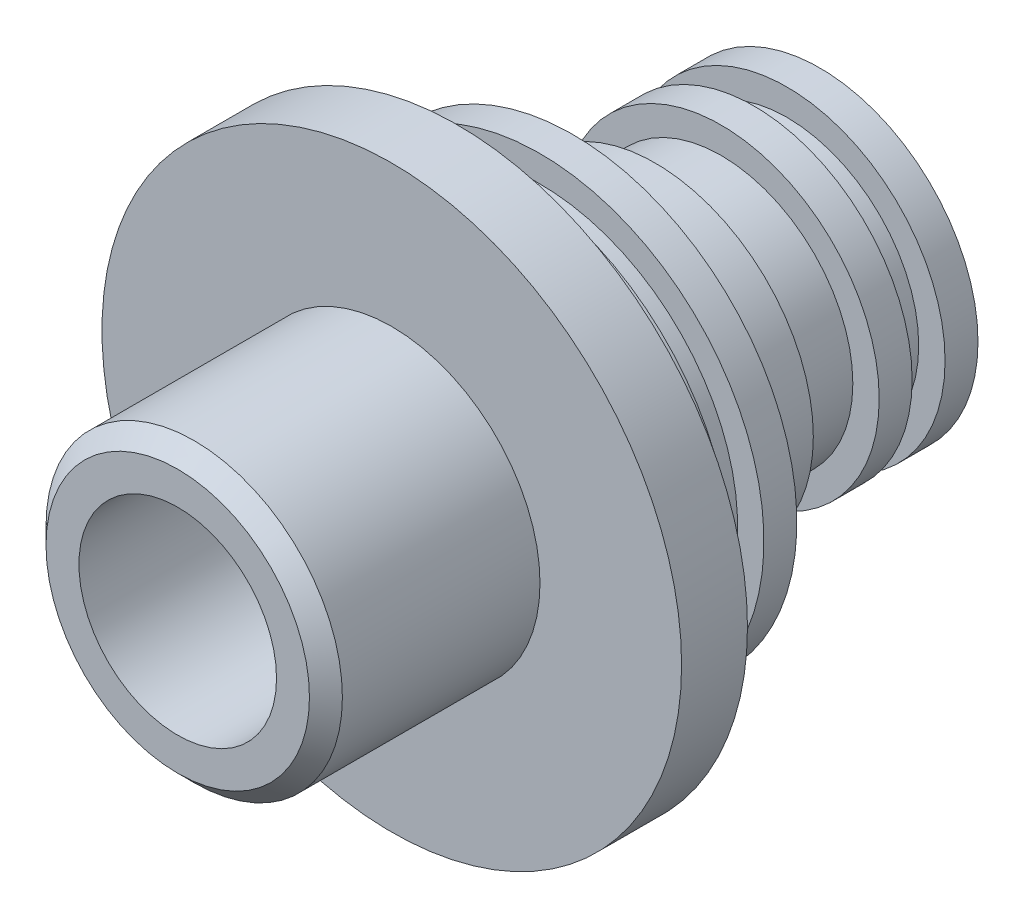
from build123d import *

# Parameters (mm, degrees)
SKETCH1_R           = 8.8
SKETCH1_R_2         = 3
BOSS_EXTRUDE1_DEPTH = 19.5
SKETCH2_OUTSIDE_W   = 25.924
SKETCH2_OUTSIDE_H   = 25.924
SKETCH2_OUTSIDE_R   = 4.5
CUT_EXTRUDE1_DEPTH  = 6.5
SKETCH3_OUTSIDE_W   = 25.924
SKETCH3_OUTSIDE_H   = 25.924
SKETCH3_OUTSIDE_R   = 6.8
CUT_EXTRUDE2_DEPTH  = 11
SKETCH5_OUTSIDE_W   = 25.924
SKETCH5_OUTSIDE_H   = 25.924
SKETCH5_OUTSIDE_R   = 4.8
CUT_EXTRUDE3_DEPTH  = 7.5
CUT_EXTRUDE4_START  = -1
SKETCH4_OUTSIDE_W   = 25.924
SKETCH4_OUTSIDE_H   = 25.924
SKETCH4_OUTSIDE_R   = 6
CUT_EXTRUDE4_DEPTH  = 1
CUT_EXTRUDE5_START  = -1
SKETCH6_OUTSIDE_W   = 25.924
SKETCH6_OUTSIDE_H   = 25.924
SKETCH6_OUTSIDE_R   = 4
CUT_EXTRUDE5_DEPTH  = 1
CUT_EXTRUDE6_START  = -3
SKETCH6_2_OUTSIDE_W = 25.924
SKETCH6_2_OUTSIDE_H = 25.924
SKETCH6_2_OUTSIDE_R = 4
CUT_EXTRUDE6_DEPTH  = 2
CHAMFER1_SIZE       = 0.5


with BuildPart() as part:
    # Sketch1 → Boss-Extrude1 (new body)
    with BuildSketch(Plane.XY):
        Circle(SKETCH1_R)
        Circle(SKETCH1_R_2, mode=Mode.SUBTRACT)
    extrude(amount=BOSS_EXTRUDE1_DEPTH)

    # Sketch2 outside → Cut-Extrude1 (cut)
    with BuildSketch(Plane.XY.offset(19.5)):
        Rectangle(SKETCH2_OUTSIDE_W, SKETCH2_OUTSIDE_H)
        Circle(SKETCH2_OUTSIDE_R, mode=Mode.SUBTRACT)
    extrude(amount=-CUT_EXTRUDE1_DEPTH, mode=Mode.SUBTRACT)

    # Sketch3 outside → Cut-Extrude2 (cut)
    with BuildSketch(Plane(origin=(0, 0, 0), x_dir=(-1, 0, 0), z_dir=(0, 0, -1))):
        Rectangle(SKETCH3_OUTSIDE_W, SKETCH3_OUTSIDE_H)
        Circle(SKETCH3_OUTSIDE_R, mode=Mode.SUBTRACT)
    extrude(amount=-CUT_EXTRUDE2_DEPTH, mode=Mode.SUBTRACT)

    # Sketch5 outside → Cut-Extrude3 (cut)
    with BuildSketch(Plane(origin=(0, 0, 0), x_dir=(-1, 0, 0), z_dir=(0, 0, -1))):
        Rectangle(SKETCH5_OUTSIDE_W, SKETCH5_OUTSIDE_H)
        Circle(SKETCH5_OUTSIDE_R, mode=Mode.SUBTRACT)
    extrude(amount=-CUT_EXTRUDE3_DEPTH, mode=Mode.SUBTRACT)

    # Sketch4 outside → Cut-Extrude4 (cut)
    with BuildSketch(Plane(origin=(0, 0, 7.5), x_dir=(-1, 0, 0), z_dir=(0, 0, -1)).offset(CUT_EXTRUDE4_START)):
        Rectangle(SKETCH4_OUTSIDE_W, SKETCH4_OUTSIDE_H)
        Circle(SKETCH4_OUTSIDE_R, mode=Mode.SUBTRACT)
    extrude(amount=-CUT_EXTRUDE4_DEPTH, mode=Mode.SUBTRACT)

    # Sketch6 outside → Cut-Extrude5 (cut)
    with BuildSketch(Plane(origin=(0, 0, 0), x_dir=(-1, 0, 0), z_dir=(0, 0, -1)).offset(CUT_EXTRUDE5_START)):
        Rectangle(SKETCH6_OUTSIDE_W, SKETCH6_OUTSIDE_H)
        Circle(SKETCH6_OUTSIDE_R, mode=Mode.SUBTRACT)
    extrude(amount=-CUT_EXTRUDE5_DEPTH, mode=Mode.SUBTRACT)

    # Sketch6<2> outside → Cut-Extrude6 (cut)
    with BuildSketch(Plane(origin=(0, 0, 0), x_dir=(-1, 0, 0), z_dir=(0, 0, -1)).offset(CUT_EXTRUDE6_START)):
        Rectangle(SKETCH6_2_OUTSIDE_W, SKETCH6_2_OUTSIDE_H)
        Circle(SKETCH6_2_OUTSIDE_R, mode=Mode.SUBTRACT)
    extrude(amount=-CUT_EXTRUDE6_DEPTH, mode=Mode.SUBTRACT)

    # Chamfer1
    chamfer1_edges = [part.edges().sort_by_distance(p)[0] for p in [
        (-4.5, 0, 19.5),
    ]]
    chamfer(chamfer1_edges, length=CHAMFER1_SIZE)


solid = part.part
